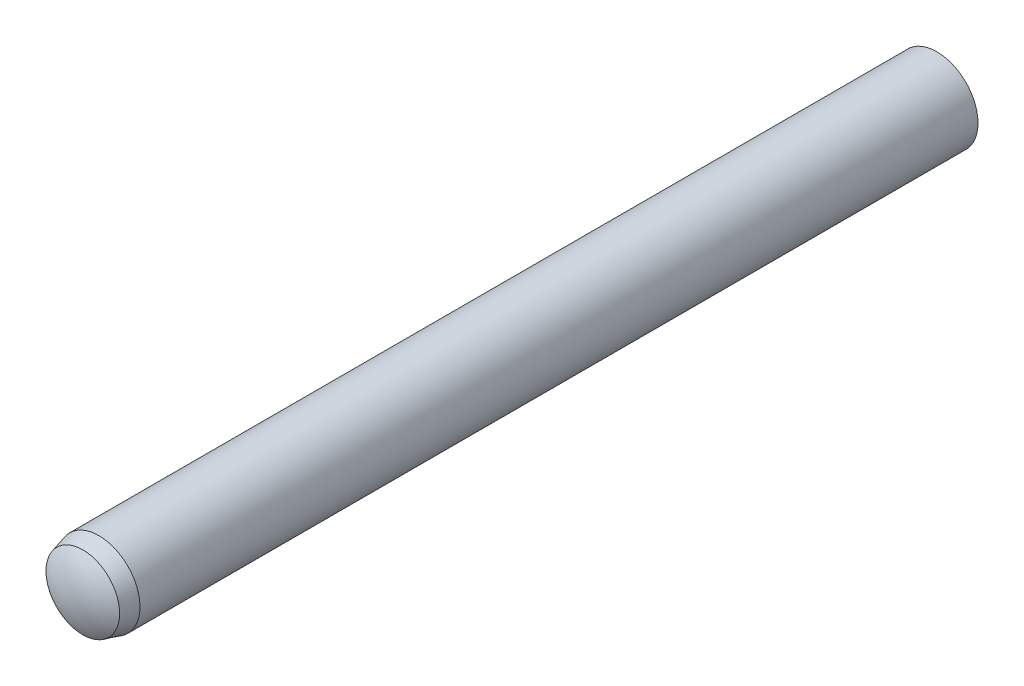
from build123d import *


with BuildPart() as part:
    # Sketch3 → Revolve1 (revolve)
    with BuildSketch(Plane(origin=(0, 0, 0), x_dir=(0, 0, -1), z_dir=(1, 0, 0))):
        with BuildLine():
            Line((-16, 0), (16, 0))
            ThreePointArc((16, 0), (15.885076627, 0.783022988), (15.55, 1.5))
            Line((15.55, 1.5), (-15.025, 1.5))
            Line((-15.025, 1.5), (-15.61, 1.343249722))
            ThreePointArc((-15.61, 1.343249722), (-15.90052754, 0.699360389), (-16, 0))
        make_face()
    revolve(axis=Axis((0, 0, 16), (0, 0, -1)))


solid = part.part
